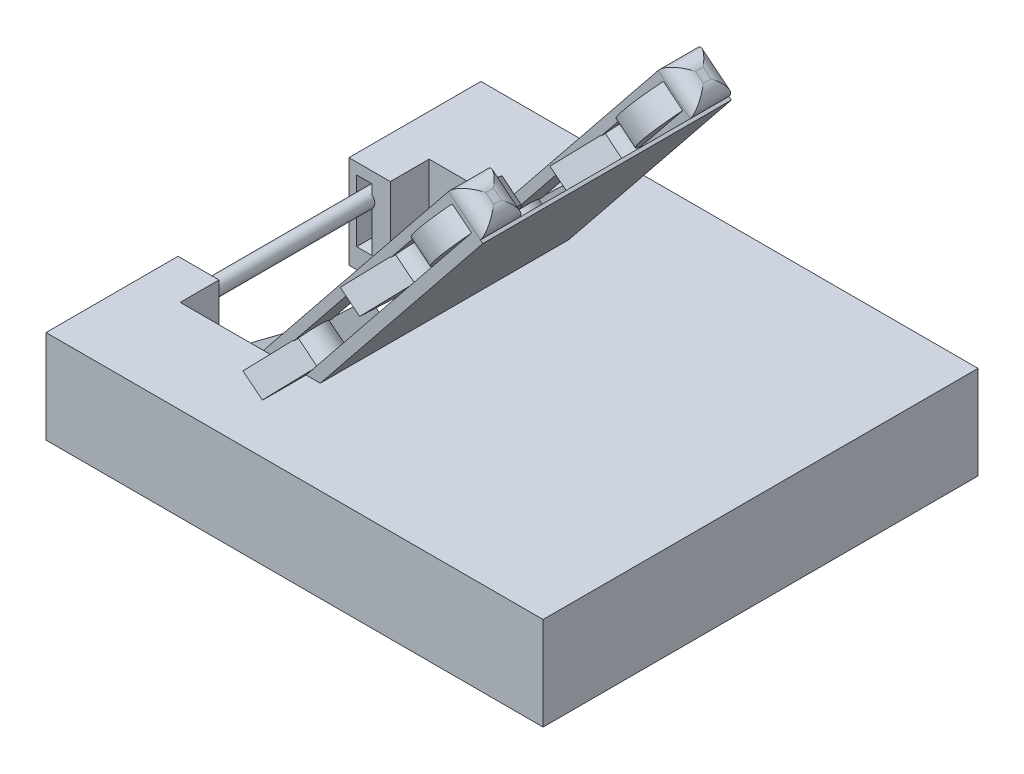
from build123d import *

# Parameters (mm, degrees)
BOSS_EXTRUDE1_DEPTH  = 152.4
CUT_EXTRUDE1_DEPTH   = 406.4
BOSS_EXTRUDE2_DEPTH  = 406.4
CUT_EXTRUDE3_DEPTH   = 508
BOSS_EXTRUDE3_DEPTH  = 25.4
BOSS_EXTRUDE4_DEPTH  = 25.4
BOSS_EXTRUDE5_DEPTH  = 12.7
BOSS_EXTRUDE6_DEPTH  = 12.7
CUT_EXTRUDE4_START   = -406.4
CUT_EXTRUDE4_DEPTH   = 406.4
FILLET1_R            = 25.4
SKETCH16_W           = 406.4
SKETCH16_H           = 431.79999999999995
BOSS_EXTRUDE8_DEPTH  = 5.08
CUT_EXTRUDE5_DEPTH   = 508
SKETCH20_W           = 25.39999999999924
SKETCH20_H           = 279.40000000000003
CUT_EXTRUDE6_DEPTH   = 508
BOSS_EXTRUDE9_DEPTH  = 40.64
SKETCH22_R           = 63.50000000000003
SKETCH22_R_2         = 63.49999999999997
BOSS_EXTRUDE10_DEPTH = 40.64
SKETCH23_R           = 38.1
CUT_EXTRUDE7_DEPTH   = 279.4
SKETCH24_W           = 279.4
SKETCH24_H           = 50.542616051246114
CUT_EXTRUDE8_DEPTH   = 182.88000000000048
SKETCH25_R           = 38.1
BOSS_EXTRUDE11_DEPTH = 279.4
BOSS_EXTRUDE12_DEPTH = 63.50000000000077
BOSS_EXTRUDE14_DEPTH = 63.50000000000077
SKETCH32_W           = 67.04968691962685
SKETCH32_H           = 63.49999999999994
SKETCH32_W_2         = 67.73333333333292
SKETCH32_H_2         = 63.49999999999997
BOSS_EXTRUDE15_DEPTH = 101.6
CUT_EXTRUDE9_DEPTH   = 25.4
SKETCH34_W           = 25.40000000000001
SKETCH34_H           = 101.6
CUT_EXTRUDE11_DEPTH  = 304.8
SKETCH36_R           = 12.7
BOSS_EXTRUDE16_DEPTH = 317.5


with BuildPart() as part:
    # Sketch1 → Boss-Extrude1 (new body)
    with BuildSketch(Plane(origin=(0, 0, 0), x_dir=(1, 0, 0), z_dir=(0, 1, 0))):
        Polygon((0, 0), (812.8, 0), (812.8000000000001, -711.1999999999999), (0, -711.1999999999999), align=None)
    extrude(amount=BOSS_EXTRUDE1_DEPTH)

    # Sketch2 → Cut-Extrude1 (cut)
    with BuildSketch(Plane(origin=(0, 0, 152.4), x_dir=(-1, 0, 0), z_dir=(0, 0, -1))):
        Polygon((0, 0), (-203.2, 152.4), (0, 152.4), align=None)
    extrude(amount=-CUT_EXTRUDE1_DEPTH, mode=Mode.SUBTRACT)

    # Sketch5 → Boss-Extrude2 (add)
    with BuildSketch(Plane.XY.offset(558.8)):
        Polygon((203.2, 152.4), (521.495119519974, 548.3194575791465), (554.1241709988542, 522.0876883607381), (256.91779556245336, 152.39999999999998), align=None)
    extrude(amount=-BOSS_EXTRUDE2_DEPTH)

    # Sketch6 → Cut-Extrude3 (cut)
    with BuildSketch(Plane(origin=(472.48898283734724, 587.7174054041558, 0), x_dir=(0.7793690109825708, -0.6265651959054618, 0), z_dir=(0.6265651959054618, 0.7793690109825708, 0))):
        Polygon((62.87924717566551, -203.2), (104.74523237533951, -203.2), (104.74523237533951, -508), (62.87924717566555, -508), align=None)
    extrude(amount=-CUT_EXTRUDE3_DEPTH, mode=Mode.SUBTRACT)

    # Sketch8 → Boss-Extrude3 (add)
    with BuildSketch(Plane(origin=(81.63518816150813, -65.62971704341768, 0), x_dir=(0, 0, -1), z_dir=(0.7793690109825717, -0.6265651959054606, 0))):
        Polygon((-558.8, 754.0938850817336), (-508, 754.0938850817336), (-508, 246.0938850817336), (-558.7999999999998, 246.0938850817336), align=None)
    extrude(amount=BOSS_EXTRUDE3_DEPTH)

    # Sketch9 → Boss-Extrude4 (add)
    with BuildSketch(Plane(origin=(81.63518816150813, -65.62971704341768, 0), x_dir=(0, 0, -1), z_dir=(0.7793690109825717, -0.6265651959054606, 0))):
        Polygon((-203.2, 754.0938850817341), (-152.39999999999998, 754.0938850817341), (-152.39999999999998, 246.09388508173413), (-203.19999999999993, 246.09388508173413), align=None)
    extrude(amount=BOSS_EXTRUDE4_DEPTH)

    # Sketch10 → Boss-Extrude5 (add)
    with BuildSketch(Plane.XY.offset(203.2)):
        Polygon((203.1999999999997, 152.40000000000092), (521.4951195199743, 548.319457579147), (573.920143877812, 506.1729323847398), (289.50826251979043, 152.39999999999992), (256.9177955624533, 152.39999999999986), (235.82905147888056, 126.16823078159206), align=None)
    extrude(amount=BOSS_EXTRUDE5_DEPTH)

    # Sketch11 → Boss-Extrude6 (add)
    with BuildSketch(Plane(origin=(0, 0, 508), x_dir=(-1, 0, 0), z_dir=(0, 0, -1))):
        Polygon((-573.9201438778116, 506.1729323847395), (-289.5082625197906, 152.40000000000015), (-256.91779556245325, 152.39999999999995), (-235.82905147888056, 126.16823078159206), (-203.1999999999997, 152.40000000000092), (-521.4951195199743, 548.319457579147), align=None)
    extrude(amount=BOSS_EXTRUDE6_DEPTH)

    # Sketch12 → Cut-Extrude4 (cut)
    with BuildSketch(Plane(origin=(0, 0, 152.39999999999975), x_dir=(-1, 0, 0), z_dir=(0, 0, -1)).offset(CUT_EXTRUDE4_START)):
        Polygon((-272.8899527583018, 152.4), (-543.4408043502763, 488.93153894227703), (-512.5781156253607, 513.7432601354462), (-222.08015203498906, 152.39999999999998), align=None)
    extrude(amount=CUT_EXTRUDE4_DEPTH, mode=Mode.SUBTRACT)

    # Fillet1
    fillet1_edges = [part.edges().sort_by_distance(p)[0] for p in [
        (547.7076316988932, 527.2461949819434, 215.89999999999998),
        (547.707631698893, 527.2461949819433, 495.3),
        (547.707631698893, 527.2461949819432, 152.39999999999998),
        (521.4951195199742, 548.3194575791467, 184.14999999999998),
        (547.7076316988928, 527.246194981943, 558.8),
        (521.4951195199742, 548.3194575791467, 527.05),
        (573.9201438778116, 506.17293238473945, 527.05),
        (573.920143877812, 506.17293238473985, 184.14999999999998),
    ]]
    fillet(fillet1_edges, radius=FILLET1_R)

    # Sketch16 → Boss-Extrude8 (add)
    with BuildSketch(Plane(origin=(101.43116104046555, -81.54447301941644, 0), x_dir=(0, 0, -1), z_dir=(0.7793690109825715, -0.6265651959054606, 0))):
        with Locations((-355.59999999999997, 512.7938850817336)):
            Rectangle(SKETCH16_W, SKETCH16_H)
    extrude(amount=BOSS_EXTRUDE8_DEPTH)

    # Sketch18 → Cut-Extrude5 (cut)
    with BuildSketch(Plane(origin=(154.19386331737303, 191.79794782500986, 0), x_dir=(0.7793690109825709, -0.6265651959054616, 0), z_dir=(0.6265651959054614, 0.7793690109825708, 0))):
        Polygon((62.8792471756653, -215.89999999999998), (4.163e-14, -215.89999999999998), (4.163e-14, -495.3), (62.8792471756653, -495.3), (104.74523237533926, -495.3), (130.1452323753393, -495.3), (130.14523237533894, -215.89999999999998), (104.74523237533926, -215.89999999999998), align=None)
    extrude(amount=-CUT_EXTRUDE5_DEPTH, mode=Mode.SUBTRACT)

    # Sketch20 → Cut-Extrude6 (cut)
    with BuildSketch(Plane(origin=(154.19386331737306, 191.79794782500986, 0), x_dir=(-0.7793690109825709, 0.6265651959054614, 0), z_dir=(-0.6265651959054614, -0.7793690109825709, 0))):
        with Locations((-117.44523237533932, -355.6)):
            Rectangle(SKETCH20_W, SKETCH20_H)
    extrude(amount=-CUT_EXTRUDE6_DEPTH, mode=Mode.SUBTRACT)

    # Sketch21 → Boss-Extrude9 (add)
    with BuildSketch(Plane(origin=(91.33693287972456, -73.42932864502501, 0), x_dir=(0, 0, 1), z_dir=(-0.7793690109825776, 0.6265651959054531, 0))):
        with BuildLine():
            Line((209.39759999999998, 562.2934659364746), (289.1018868532613, 546.366600042237))
            Line((289.1018868532613, 546.366600042237), (210.56545348218663, 525.4269956202154))
            ThreePointArc((210.56545348218663, 525.4269956202154), (185.1552700280405, 511.30785991563), (158.90239999999997, 523.7904170057728))
            Line((158.90239999999997, 523.7904170057728), (79.93520930816898, 543.0419414711238))
            Line((79.93520930816898, 543.0419414711238), (158.90239999999997, 562.2934659364746))
            ThreePointArc((158.90239999999997, 562.2934659364746), (184.14999999999998, 574.7919414711238), (209.39759999999998, 562.2934659364746))
        make_face()
        with BuildLine():
            Line((289.1018868532613, 292.366600042237), (210.56545348218663, 271.42699562021545))
            ThreePointArc((210.56545348218663, 271.42699562021545), (185.15527002804046, 257.30785991563005), (158.90239999999997, 269.7904170057729))
            Line((158.90239999999997, 269.7904170057729), (79.93520930816898, 289.0419414711237))
            Line((79.93520930816898, 289.0419414711237), (158.90239999999997, 308.29346593647455))
            ThreePointArc((158.90239999999997, 308.29346593647455), (184.14999999999998, 320.7919414711238), (209.39759999999998, 308.29346593647455))
            Line((209.39759999999998, 308.29346593647455), (289.1018868532613, 292.366600042237))
        make_face()
        with BuildLine():
            Line((632.0018868532613, 292.36660004223734), (553.4654534821866, 271.4269956202158))
            ThreePointArc((553.4654534821866, 271.4269956202158), (528.0552700280405, 257.3078599156303), (501.8024, 269.79041700577324))
            Line((501.8024, 269.79041700577324), (422.835209308169, 289.04194147112406))
            Line((422.835209308169, 289.04194147112406), (501.8024, 308.2934659364749))
            ThreePointArc((501.8024, 308.2934659364749), (527.0500000000001, 320.791941471124), (552.2976, 308.2934659364749))
            Line((552.2976, 308.2934659364749), (632.0018868532613, 292.36660004223734))
        make_face()
        with BuildLine():
            Line((501.8024, 523.7904170057732), (422.835209308169, 543.041941471124))
            Line((422.835209308169, 543.041941471124), (501.8024, 562.293465936475))
            ThreePointArc((501.8024, 562.293465936475), (527.0500000000001, 574.791941471124), (552.2976, 562.293465936475))
            Line((552.2976, 562.293465936475), (632.0018868532613, 546.3666000422373))
            Line((632.0018868532613, 546.3666000422373), (553.4654534821866, 525.4269956202157))
            ThreePointArc((553.4654534821866, 525.4269956202157), (528.0552700280405, 511.3078599156302), (501.8024, 523.7904170057732))
        make_face()
    extrude(amount=BOSS_EXTRUDE9_DEPTH)

    # Sketch22 → Boss-Extrude10 (add)
    with BuildSketch(Plane(origin=(91.33693287972456, -73.42932864502501, 0), x_dir=(0, 0, 1), z_dir=(-0.7793690109825776, 0.6265651959054531, 0))):
        with Locations((184.14999999999998, 670.4976110611291)):
            Circle(SKETCH22_R)
        with Locations((519.43, 670.4976110611292)):
            Circle(SKETCH22_R_2)
    extrude(amount=BOSS_EXTRUDE10_DEPTH)

    # Sketch23 → Cut-Extrude7 (cut)
    with BuildSketch(Plane.XY.offset(215.89999999999998)):
        with Locations((203.2, 12.700000000001378)):
            Circle(SKETCH23_R)
    extrude(amount=CUT_EXTRUDE7_DEPTH, mode=Mode.SUBTRACT)

    # Sketch24 → Cut-Extrude8 (cut)
    with BuildSketch(Plane.ZY):
        with Locations((355.59999999999997, 25.271308025623057)):
            Rectangle(SKETCH24_W, SKETCH24_H)
    extrude(amount=-CUT_EXTRUDE8_DEPTH, mode=Mode.SUBTRACT)

    # Sketch25 → Boss-Extrude11 (add)
    with BuildSketch(Plane.XY.offset(215.89999999999998)):
        with Locations((203.2, 12.700000000001378)):
            Circle(SKETCH25_R)
    extrude(amount=BOSS_EXTRUDE11_DEPTH)

    # Sketch26 → Boss-Extrude12 (add)
    with BuildSketch(Plane.XY.offset(215.89999999999998)):
        Polygon((0, 0), (-6.22e-15, 50.8), (67.73333333333265, 50.8), align=None)
    extrude(amount=-BOSS_EXTRUDE12_DEPTH)

    # Sketch30 → Boss-Extrude14 (add)
    with BuildSketch(Plane(origin=(0, 0, 495.3), x_dir=(-1, 0, 0), z_dir=(0, 0, -1))):
        Polygon((2.776e-14, -2.776e-14), (0, 50.79999999999997), (-67.73333333333278, 50.79999999999996), align=None)
    extrude(amount=-BOSS_EXTRUDE14_DEPTH)

    # Sketch32 → Boss-Extrude15 (add)
    with BuildSketch(Plane(origin=(5.2e-15, 50.79999999999997, 0), x_dir=(1, -1e-16, 0), z_dir=(1e-16, 1, 0))):
        with Locations((33.524843459813425, -527.05)):
            Rectangle(SKETCH32_W, SKETCH32_H)
        with Locations((33.86666666666645, -184.14999999999998)):
            Rectangle(SKETCH32_W_2, SKETCH32_H_2)
    extrude(amount=BOSS_EXTRUDE15_DEPTH)

    # Sketch33 → Cut-Extrude9 (cut)
    with BuildSketch(Plane.XY.offset(215.89999999999998)):
        Polygon((12.69999999999997, 134.2251095976107), (38.099999999999966, 134.2251095976107), (38.09999999999998, 32.625109597610695), (12.699999999999983, 32.625109597610695), align=None)
    extrude(amount=-CUT_EXTRUDE9_DEPTH, mode=Mode.SUBTRACT)

    # Sketch34 → Cut-Extrude11 (cut)
    with BuildSketch(Plane.XY.offset(215.89999999999998)):
        with Locations((25.399999999999977, 83.4251095976107)):
            Rectangle(SKETCH34_W, SKETCH34_H)
    extrude(amount=CUT_EXTRUDE11_DEPTH, mode=Mode.SUBTRACT)

    # Sketch36 → Boss-Extrude16 (add)
    with BuildSketch(Plane.XY.offset(190.49999999999997)):
        with Locations(Location((29.63333333333292, 108.82510959761069, 0), (0, 0, 311.810314896))):
            Circle(SKETCH36_R)
    extrude(amount=BOSS_EXTRUDE16_DEPTH)


solid = part.part
